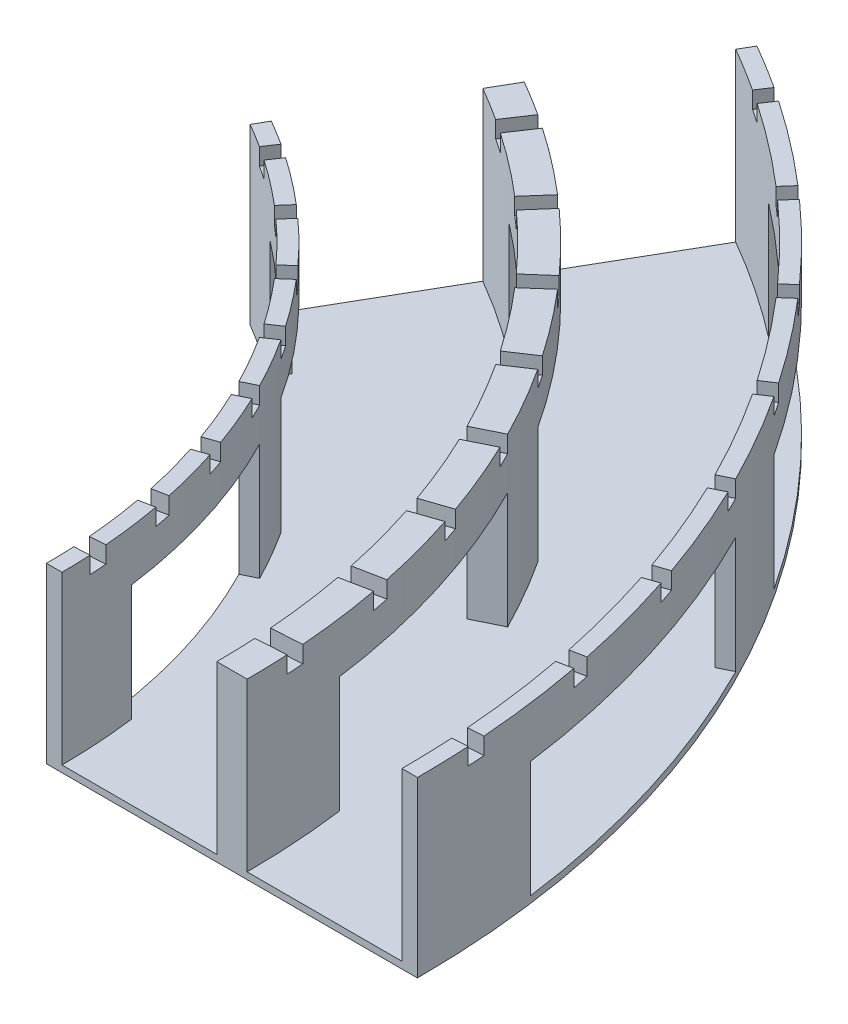
from build123d import *

# Parameters (mm, degrees)
AUFSATZ_LINEAR_AUSTRAGEN1_DEPTH   = 51.5
AUFSATZ_LINEAR_AUSTRAGEN1_2_DEPTH = 51.5
AUFSATZ_LINEAR_AUSTRAGEN1_3_DEPTH = 51.5
SCHNITT_LINEAR_START              = -5
SCHNITT_LINEAR_AUSTRAGEN1_DEPTH   = 5
AUFSATZ_LINEAR_AUSTRAGEN2_DEPTH   = 2
SCHNITT_LINEAR_START_2            = -49.5
SCHNITT_LINEAR_AUSTRAGEN2_DEPTH   = 34.5


with BuildPart() as part:
    # Skizze1 → Aufsatz-Linear austragen1 (new body)
    with BuildSketch(Plane(origin=(0, 0, 0), x_dir=(1, 0, 0), z_dir=(0, 1, 0))):
        with BuildLine():
            Line((165, 0), (169.6, 0))
            ThreePointArc((169.6, 0), (146.877908482, 84.8), (84.8, 146.877908482))
            Line((84.8, 146.877908482), (82.5, 142.894191624))
            ThreePointArc((82.5, 142.894191624), (142.894191624, 82.5), (165, 0))
        make_face()
    extrude(amount=AUFSATZ_LINEAR_AUSTRAGEN1_DEPTH)


with BuildPart() as body_2:
    # Skizze1 → Aufsatz-Linear austragen1 2 (new body)
    with BuildSketch(Plane(origin=(0, 0, 0), x_dir=(1, 0, 0), z_dir=(0, 1, 0))):
        with BuildLine():
            Line((215.5, 0), (224.5, 0))
            ThreePointArc((224.5, 0), (194.42270315, 112.25), (112.25, 194.42270315))
            Line((112.25, 194.42270315), (107.75, 186.628474516))
            ThreePointArc((107.75, 186.628474516), (186.628474516, 107.75), (215.5, 0))
        make_face()
    extrude(amount=AUFSATZ_LINEAR_AUSTRAGEN1_2_DEPTH)


with BuildPart() as body_3:
    # Skizze1 → Aufsatz-Linear austragen1 3 (new body)
    with BuildSketch(Plane(origin=(0, 0, 0), x_dir=(1, 0, 0), z_dir=(0, 1, 0))):
        with BuildLine():
            Line((135.2, 234.173269183), (137.5, 238.156986041))
            ThreePointArc((137.5, 238.156986041), (238.156986041, 137.5), (275, 0))
            Line((275, 0), (270.4, 0))
            ThreePointArc((270.4, 0), (234.173269183, 135.2), (135.2, 234.173269183))
        make_face()
    extrude(amount=AUFSATZ_LINEAR_AUSTRAGEN1_3_DEPTH)


with BuildPart() as schnitt_linear_austragen1_tool:
    # Skizze2 → Schnitt-Linear austragen1 (new body)
    with BuildSketch(Plane(origin=(0, 51.5, 0), x_dir=(1, 0, 0), z_dir=(0, 1, 0)).offset(SCHNITT_LINEAR_START)):
        with BuildLine():
            Line((164.464314583, 13.284924864), (274.236356527, 20.479764614))
            ThreePointArc((274.236356527, 20.479764614), (274.411203891, 17.985860538), (274.563372173, 15.490469997))
            Line((274.563372173, 15.490469997), (164.791330229, 8.295630248))
            ThreePointArc((164.791330229, 8.295630248), (164.646722334, 10.791516323), (164.464314583, 13.284924864))
        make_face()
        with BuildLine():
            Line((161.323268916, 34.638171229), (269.217080788, 56.099584774))
            ThreePointArc((269.217080788, 56.099584774), (269.715952111, 53.649838554), (270.192532398, 51.195658372))
            Line((270.192532398, 51.195658372), (162.298720527, 29.734244827))
            ThreePointArc((162.298720527, 29.734244827), (161.829571267, 32.189903133), (161.323268916, 34.638171229))
        make_face()
        with BuildLine():
            Line((157.029134718, 50.664098233), (261.198623482, 86.024874838))
            ThreePointArc((261.198623482, 86.024874838), (260.405785611, 88.395852958), (259.591426156, 90.759525485))
            Line((259.591426156, 90.759525485), (155.421937391, 55.398748881))
            ThreePointArc((155.421937391, 55.398748881), (156.243471367, 53.037511775), (157.029134718, 50.664098233))
        make_face()
        with BuildLine():
            Line((149.072736877, 70.727074872), (247.735533701, 119.382181845))
            ThreePointArc((247.735533701, 119.382181845), (246.640003921, 121.62938981), (245.52409025, 123.866545552))
            Line((245.52409025, 123.866545552), (146.861293426, 75.211438579))
            ThreePointArc((146.861293426, 75.211438579), (147.984002353, 72.977633886), (149.072736877, 70.727074872))
        make_face()
        with BuildLine():
            Line((138.565663178, 89.57989165), (230.033620252, 150.696826621))
            ThreePointArc((230.033620252, 150.696826621), (228.654143383, 152.78181408), (227.255769087, 154.854174683))
            Line((227.255769087, 154.854174683), (135.787812013, 93.737239712))
            ThreePointArc((135.787812013, 93.737239712), (137.19248603, 91.669088448), (138.565663178, 89.57989165))
        make_face()
        with BuildLine():
            Line((125.687692564, 106.899971646), (208.395767784, 179.433006913))
            ThreePointArc((208.395767784, 179.433006913), (206.755947057, 181.320099153), (205.099038708, 183.19220595))
            Line((205.099038708, 183.19220595), (122.390963489, 110.659170683))
            ThreePointArc((122.390963489, 110.659170683), (124.053568234, 108.792059492), (125.687692564, 106.899971646))
        make_face()
        with BuildLine():
            Line((110.659170683, 122.390963489), (183.19220595, 205.099038708))
            ThreePointArc((183.19220595, 205.099038708), (181.320099153, 206.755947057), (179.433006913, 208.395767784))
            Line((179.433006913, 208.395767784), (106.899971646, 125.687692564))
            ThreePointArc((106.899971646, 125.687692564), (108.792059492, 124.053568234), (110.659170683, 122.390963489))
        make_face()
        with BuildLine():
            Line((93.737239712, 135.787812013), (154.854174683, 227.255769087))
            ThreePointArc((154.854174683, 227.255769087), (152.78181408, 228.654143383), (150.696826621, 230.033620252))
            Line((150.696826621, 230.033620252), (89.57989165, 138.565663178))
            ThreePointArc((89.57989165, 138.565663178), (91.669088448, 137.19248603), (93.737239712, 135.787812013))
        make_face()
    extrude(amount=SCHNITT_LINEAR_AUSTRAGEN1_DEPTH)


with BuildPart() as part_1:
    add(part.part)

    # Schnitt-Linear austragen1: cut by schnitt_linear_austragen1_tool
    add(schnitt_linear_austragen1_tool.part, mode=Mode.SUBTRACT)



with BuildPart() as body_2_1:
    add(body_2.part)

    # Schnitt-Linear austragen1: cut by schnitt_linear_austragen1_tool
    add(schnitt_linear_austragen1_tool.part, mode=Mode.SUBTRACT)


with BuildPart() as body_3_1:
    add(body_3.part)

    # Schnitt-Linear austragen1: cut by schnitt_linear_austragen1_tool
    add(schnitt_linear_austragen1_tool.part, mode=Mode.SUBTRACT)


with BuildPart() as part_2:
    add(part_1.part)

    add(body_2_1.part)  # Aufsatz-Linear austragen2 merges body 2

    add(body_3_1.part)  # Aufsatz-Linear austragen2 merges body 3
    # Skizze4 → Aufsatz-Linear austragen2 (add)
    with BuildSketch(Plane.XZ):
        with BuildLine():
            Line((165, 0), (275, 0))
            ThreePointArc((275, 0), (238.156986041, -137.5), (137.5, -238.156986041))
            Line((137.5, -238.156986041), (82.5, -142.894191624))
            ThreePointArc((82.5, -142.894191624), (142.894191624, -82.5), (165, 0))
        make_face()
    extrude(amount=-AUFSATZ_LINEAR_AUSTRAGEN2_DEPTH)

    # Skizze5 → Schnitt-Linear austragen2 (cut)
    with BuildSketch(Plane(origin=(0, 51.5, 0), x_dir=(1, 0, 0), z_dir=(0, 1, 0)).offset(SCHNITT_LINEAR_START_2)):
        with BuildLine():
            Line((100.445635786, 130.903301148), (167.409392977, 218.17216858))
            ThreePointArc((167.409392977, 218.17216858), (201.565045666, 187.073601466), (230.033620252, 150.696826621))
            Line((230.033620252, 150.696826621), (138.565663178, 89.57989165))
            ThreePointArc((138.565663178, 89.57989165), (121.278630852, 111.877136622), (100.445635786, 130.903301148))
        make_face()
        with BuildLine():
            Line((163.588402127, 21.536821716), (272.647336878, 35.894702861))
            ThreePointArc((272.647336878, 35.894702861), (262.79301408, 81.023649329), (245.52409025, 123.866545552))
            Line((245.52409025, 123.866545552), (146.861293426, 75.211438579))
            ThreePointArc((146.861293426, 75.211438579), (157.527757843, 49.091806943), (163.588402127, 21.536821716))
        make_face()
    extrude(amount=SCHNITT_LINEAR_AUSTRAGEN2_DEPTH, mode=Mode.SUBTRACT)


solid = part_2.part
